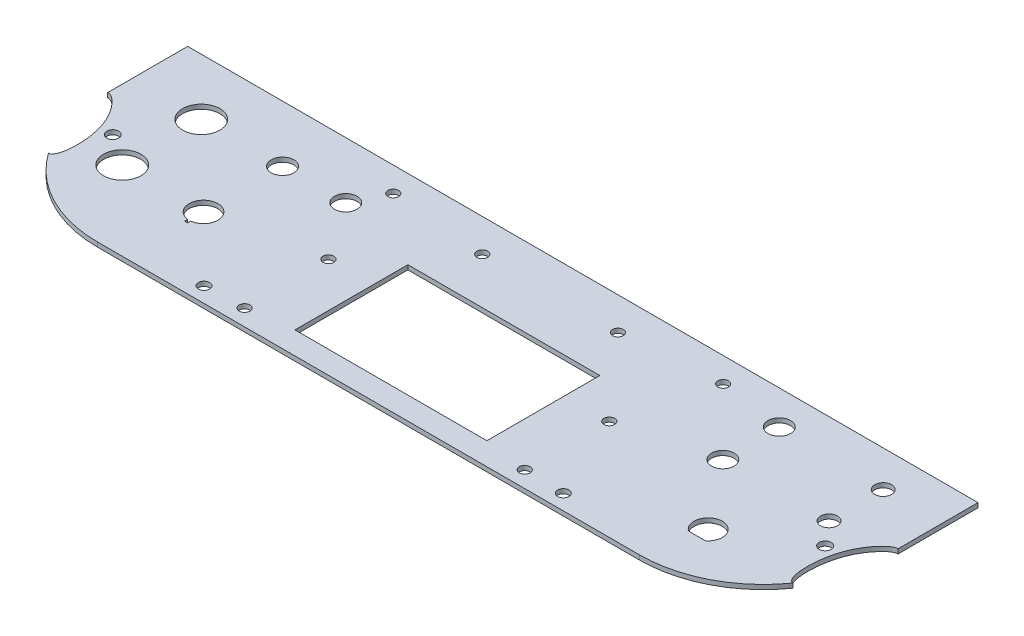
from build123d import *

# Parameters (mm, degrees)
BOSS_EXTRUDE1_DEPTH = 2.54
SKETCH2_W           = 107.95
SKETCH2_H           = 63.5
CUT_EXTRUDE1_DEPTH  = 238.771783963
CUT_EXTRUDE4_START  = -2.54
CUT_EXTRUDE4_DEPTH  = 2.54
SKETCH4_R           = 4.7625
SKETCH4_R_2         = 6.35
SKETCH4_R_3         = 10.5
SKETCH4_R_4         = 3.025
CUT_EXTRUDE3_DEPTH  = 238.771784093
SKETCH6_R           = 3.013751163
SKETCH6_R_2         = 3.176772659
SKETCH6_R_3         = 3.378822927
CUT_EXTRUDE5_DEPTH  = 238.771784093


with BuildPart() as part:
    # Sketch1 → Boss-Extrude1 (new body)
    with BuildSketch(Plane(origin=(0, 0, 0), x_dir=(1, 0, 0), z_dir=(0, 1, 0))):
        with BuildLine():
            Line((222.25, -14.612459999), (222.25, 36.187540001))
            Line((222.25, 36.187540001), (-222.25, 36.187540001))
            Line((-222.25, 36.187540001), (-222.25, -14.612459999))
            ThreePointArc((-222.25, -14.612459999), (-201.791408666, -64.003868664), (-152.4, -84.462459999))
            Line((-152.4, -84.462459999), (152.4, -84.462459999))
            ThreePointArc((152.4, -84.462459999), (201.791408666, -64.003868664), (222.25, -14.612459999))
        make_face()
    extrude(amount=BOSS_EXTRUDE1_DEPTH)

    # Sketch2 → Cut-Extrude1 (cut, through all)
    with BuildSketch(Plane(origin=(0, 2.54, 0), x_dir=(1, 0, 0), z_dir=(0, 1, 0))):
        with Locations((0, -40.012459999)):
            Rectangle(SKETCH2_W, SKETCH2_H)
    extrude(amount=-CUT_EXTRUDE1_DEPTH, mode=Mode.SUBTRACT)

    # Sketch5 → Cut-Extrude4 (cut)
    with BuildSketch(Plane(origin=(0, 2.54, 0), x_dir=(1, 0, 0), z_dir=(0, 1, 0)).offset(CUT_EXTRUDE4_START)):
        with BuildLine():
            ThreePointArc((-222.25, -14.612459999), (-218.970589391, -35.763798683), (-209.440289817, -54.929055063))
            add(Edge.make_bspline(
                [(-209.440289817, -54.929055063), (-204.823931799, -55.506078622), (-202.304901657, -25.266816537), (-219.26819847, -8.373976847), (-222.25, -8.829558466)],
                knots=[0, 0, 0, 0, 0.32580352, 0.516674914, 0.516674914, 0.516674914, 0.516674914], degree=3))
            Line((-222.25, -8.829558466), (-222.25, -14.612459999))
        make_face()
        with BuildLine():
            add(Edge.make_bspline(
                [(-222.25, -8.829558466), (-229.800526338, -9.983183543), (-216.288594077, -54.073048471), (-209.440289817, -54.929055063)],
                knots=[0.516674914, 0.516674914, 0.516674914, 0.516674914, 1, 1, 1, 1], degree=3))
            ThreePointArc((-209.440289817, -54.929055063), (-218.970589391, -35.763798683), (-222.25, -14.612459999))
            Line((-222.25, -14.612459999), (-222.25, -8.829558466))
        make_face()
        with BuildLine():
            add(Edge.make_bspline(
                [(209.440289817, -54.929055063), (204.823931799, -55.506078622), (202.304901657, -25.266816537), (235.136564978, 7.428480335), (216.288594077, -54.073048471), (209.440289817, -54.929055063)],
                knots=[0, 0, 0, 0, 0.32580352, 0.516674914, 1, 1, 1, 1], degree=3))
        make_face()
    extrude(amount=CUT_EXTRUDE4_DEPTH, mode=Mode.SUBTRACT)

    # Sketch4 → Cut-Extrude3 (cut, through all)
    with BuildSketch(Plane(origin=(0, 2.54, 0), x_dir=(1, 0, 0), z_dir=(0, 1, 0))):
        with Locations(Location((189.23, 15.867540001, 0), (0, 0, 270))):
            Circle(SKETCH4_R)
        with Locations(Location((-137.16, 4.437540001, 0), (0, 0, 270))):
            Circle(SKETCH4_R_2)
        with Locations(Location((129.54, 17.137540001, 0), (0, 0, 270))):
            Circle(SKETCH4_R_2)
        with Locations(Location((129.54, -14.612459999, 0), (0, 0, 270))):
            Circle(SKETCH4_R_2)
        with Locations(Location((189.23, -14.612459999, 0), (0, 0, 270))):
            Circle(SKETCH4_R)
        with Locations(Location((-182.88, -40.012459999, 0), (0, 0, 270))):
            Circle(SKETCH4_R_3)
        with Locations(Location((-182.88, 4.437540001, 0), (0, 0, 270))):
            Circle(SKETCH4_R_3)
        with Locations(Location((-101.6, 4.437540001, 0), (0, 0, 270))):
            Circle(SKETCH4_R_2)
        with Locations(Location((-38.130967929, 17.745240001, 0), (0, 0, 270))):
            Circle(SKETCH4_R_4)
        with Locations(Location((-79, -27.947459999, 0), (0, 0, 270))):
            Circle(SKETCH4_R_4)
        with Locations(Location((-78.7827, -75.287459999, 0), (0, 0, 270))):
            Circle(SKETCH4_R_4)
        with Locations(Location((78.7827, -75.287459999, 0), (0, 0, 270))):
            Circle(SKETCH4_R_4)
        with Locations(Location((79, -27.947459999, 0), (0, 0, 270))):
            Circle(SKETCH4_R_4)
        with Locations(Location((38.130967929, 17.745240001, 0), (0, 0, 270))):
            Circle(SKETCH4_R_4)
        with BuildLine():
            Line((-138.01, -48.067737772), (-138.01, -49.812459999))
            Line((-138.01, -49.812459999), (-136.31, -49.812459999))
            Line((-136.31, -49.812459999), (-136.31, -48.067737772))
            ThreePointArc((-136.31, -48.067737772), (-137.16, -31.912459999), (-138.01, -48.067737772))
        make_face()
        with BuildLine():
            Line((164.1475, -59.062459999), (154.6225, -59.062459999))
            ThreePointArc((154.6225, -59.062459999), (159.385, -44.774959999), (164.1475, -59.062459999))
        make_face()
    extrude(amount=-CUT_EXTRUDE3_DEPTH, mode=Mode.SUBTRACT)

    # Sketch6 → Cut-Extrude5 (cut, through all)
    with BuildSketch(Plane.XZ):
        with Locations(Location((92.768348893, -22.335077387, 0), (0, 0, 270))):
            Circle(SKETCH6_R)
        with Locations(Location((101.056164591, 75.862981341, 0), (0, 0, 270))):
            Circle(SKETCH6_R_2)
        with Locations(Location((200.350154748, 27.883658386, 0), (0, 0, 270))):
            Circle(SKETCH6_R_3)
        with Locations(Location((-92.768348893, -22.335077387, 0), (0, 0, 90))):
            Circle(SKETCH6_R)
        with Locations(Location((-200.350154748, 27.883658386, 0), (0, 0, 90))):
            Circle(SKETCH6_R_3)
        with Locations(Location((-101.056164591, 75.862981341, 0), (0, 0, 90))):
            Circle(SKETCH6_R_2)
    extrude(amount=-CUT_EXTRUDE5_DEPTH, mode=Mode.SUBTRACT)


solid = part.part
